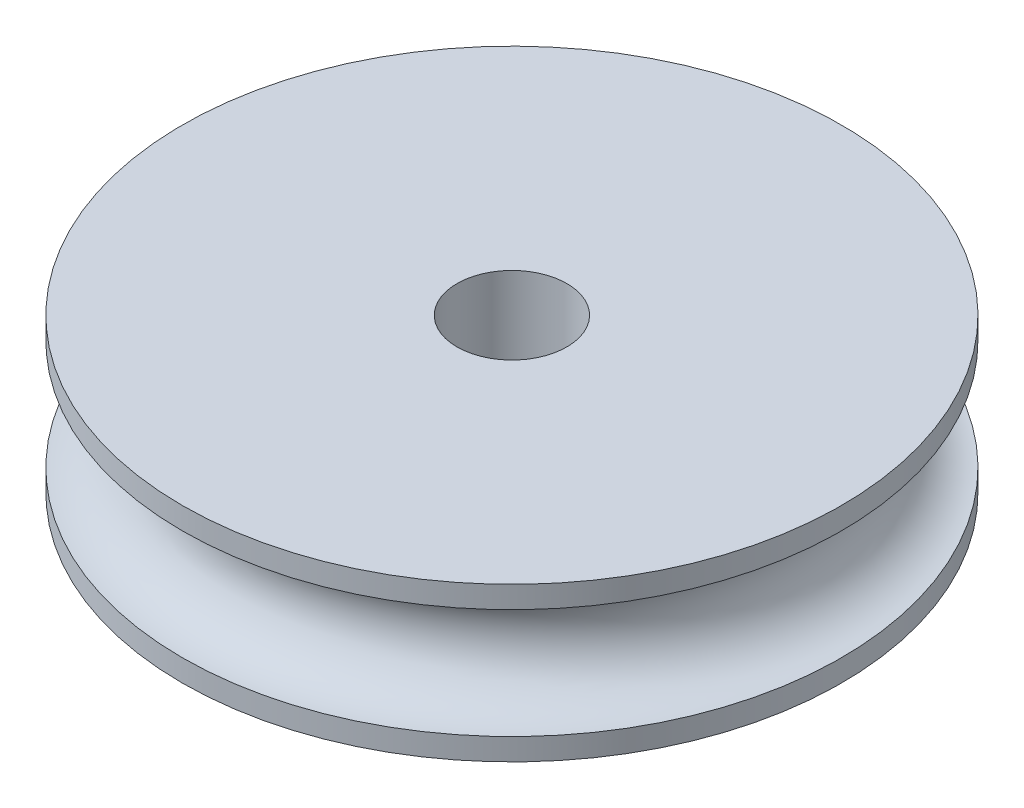
from build123d import *

# Parameters (mm, degrees)
SKETCH2_R          = 3.175
CUT_EXTRUDE1_DEPTH = 29.369651038


with BuildPart() as part:
    # Sketch1 → Revolve1 (revolve)
    with BuildSketch(Plane(origin=(0, 0, 0), x_dir=(0, 0, -1), z_dir=(1, 0, 0)), mode=Mode.PRIVATE) as revolve1_sk:
        with BuildLine():
            ThreePointArc((19.05, 3.175), (15.875, 0), (19.05, -3.175))
            Line((19.05, -3.175), (19.05, -4.445))
            Line((19.05, -4.445), (0, -4.445))
            Line((0, -4.445), (0, 4.445))
            Line((0, 4.445), (19.05, 4.445))
            Line((19.05, 4.445), (19.05, 3.175))
        make_face()
    revolve(revolve1_sk.sketch.rotate(Axis((0, 4.445, 0), (0, -1, 0)), 180), axis=Axis((0, 4.445, 0), (0, -1, 0)))

    # Sketch2 → Cut-Extrude1 (cut, through all)
    with BuildSketch(Plane(origin=(0, 4.445, 0), x_dir=(1, 0, 0), z_dir=(0, 1, 0))):
        with Locations(Location((0, 0, 0), (0, 0, 270))):
            Circle(SKETCH2_R)
    extrude(amount=-CUT_EXTRUDE1_DEPTH, mode=Mode.SUBTRACT)


solid = part.part
